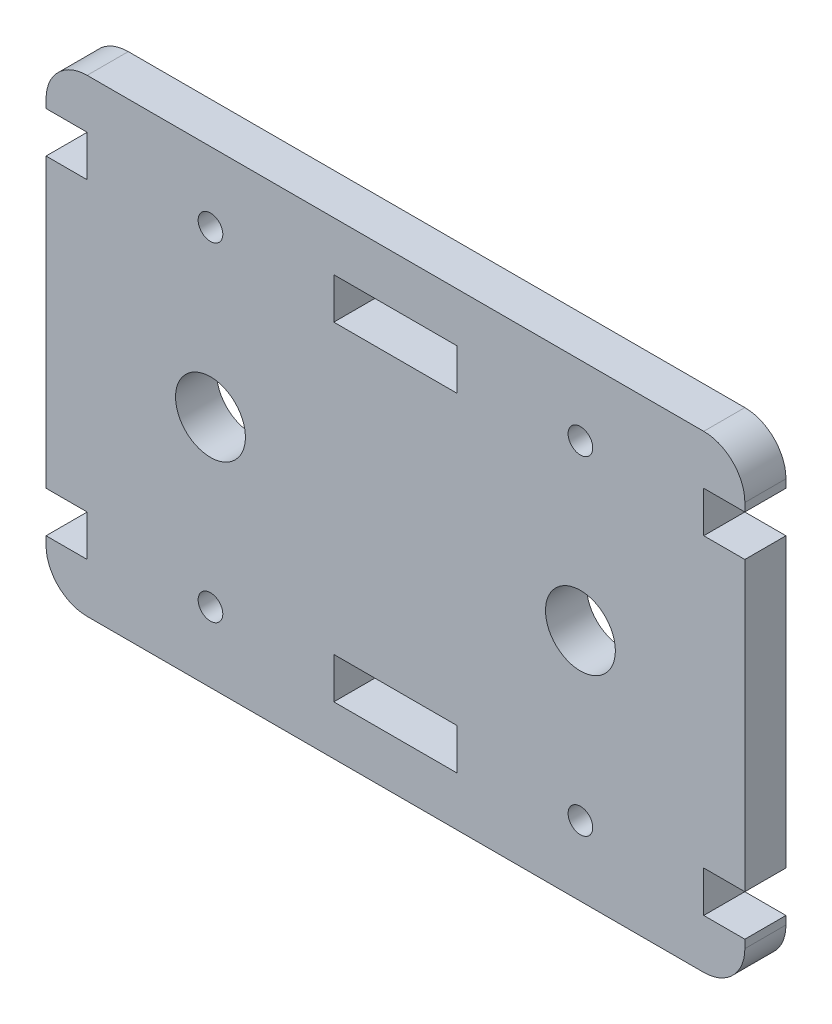
from build123d import *

# Parameters (mm, degrees)
ESQUISSE1_R        = 1.5
ESQUISSE1_R_2      = 4.25
BOSS_EXTRU_1_DEPTH = 5
CONG_1_R           = 5


with BuildPart() as part:
    # Esquisse1 → Boss.-Extru.1 (new body)
    with BuildSketch(Plane.XY):
        Polygon((-20, 0), (20, 0), (20, 6), (15, 6), (15, 11), (20, 11), (20, 46), (15, 46), (15, 51), (20, 51), (20, 57), (-20, 57), (-25, 57), (-65, 57), (-65, 51), (-60, 51), (-60, 46), (-65, 46), (-65, 11), (-60, 11), (-60, 6), (-65, 6), (-65, 0), (-25, 0), align=None)
        with Locations((0, 48.5)):
            Circle(ESQUISSE1_R, mode=Mode.SUBTRACT)
        with Locations((0, 8.5)):
            Circle(ESQUISSE1_R, mode=Mode.SUBTRACT)
        with Locations((0, 28.5)):
            Circle(ESQUISSE1_R_2, mode=Mode.SUBTRACT)
        with Locations(Location((-45, 8.5, 0), (0, 0, 180))):
            Circle(ESQUISSE1_R, mode=Mode.SUBTRACT)
        with Locations(Location((-45, 28.5, 0), (0, 0, 180))):
            Circle(ESQUISSE1_R_2, mode=Mode.SUBTRACT)
        with Locations(Location((-45, 48.5, 0), (0, 0, 180))):
            Circle(ESQUISSE1_R, mode=Mode.SUBTRACT)
        Polygon((-20, 51), (-15, 51), (-15, 46), (-20, 46), (-25, 46), (-30, 46), (-30, 51), (-25, 51), align=None, mode=Mode.SUBTRACT)
        Polygon((-20, 11), (-15, 11), (-15, 6), (-20, 6), (-25, 6), (-30, 6), (-30, 11), (-25, 11), align=None, mode=Mode.SUBTRACT)
    extrude(amount=BOSS_EXTRU_1_DEPTH)

    # Congé1
    cong_1_edges = [part.edges().sort_by_distance(p)[0] for p in [
        (-65, 0, 2.5),
        (-65, 57, 2.5),
        (20, 57, 2.5),
        (20, 0, 2.5),
    ]]
    fillet(cong_1_edges, radius=CONG_1_R)


solid = part.part
